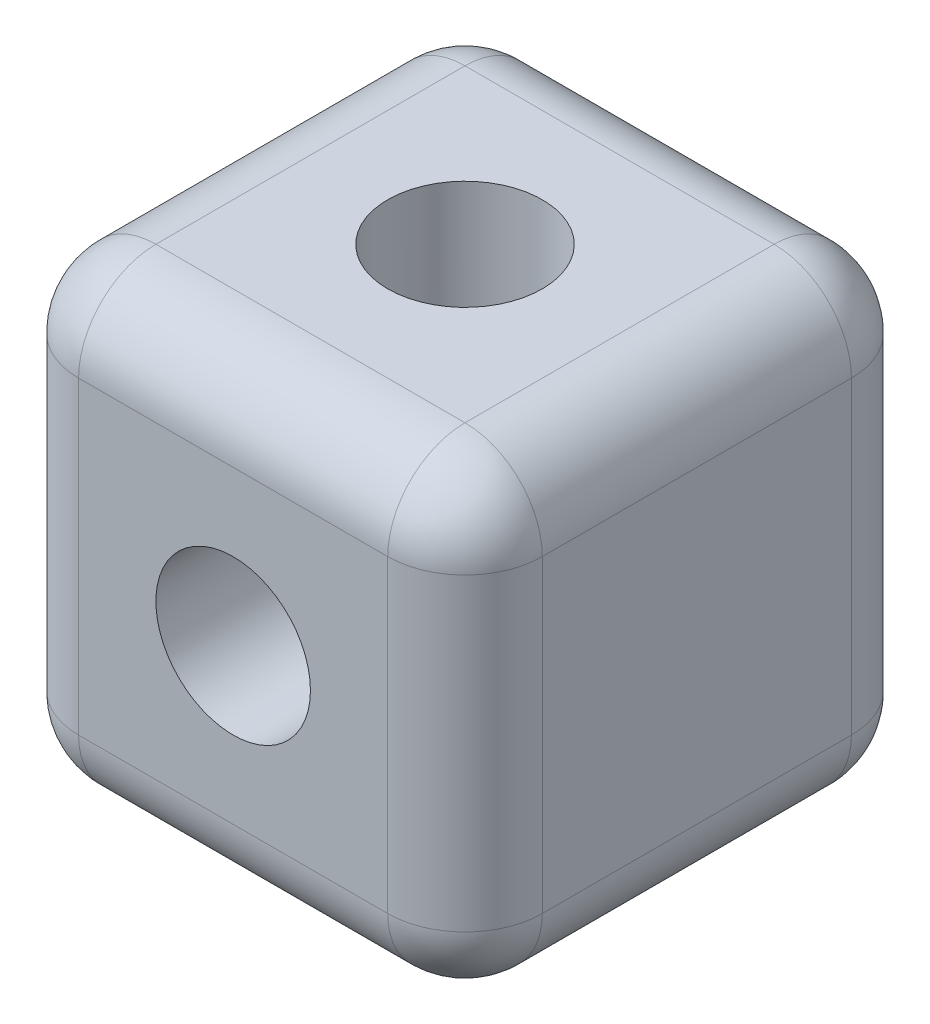
from build123d import *

# Parameters (mm, degrees)
SKETCH3_W           = 6
SKETCH3_H           = 6
BOSS_EXTRUDE1_DEPTH = 6
SKETCH4_R           = 1
CUT_EXTRUDE1_DEPTH  = 6
CUT_EXTRUDE2_REACH  = 9.348
SKETCH5_R           = 1
FILLET1_R           = 1


with BuildPart() as part:
    # Sketch3 → Boss-Extrude1 (new body)
    with BuildSketch(Plane(origin=(0, 0, 0), x_dir=(1, 0, 0), z_dir=(0, 1, 0))):
        Rectangle(SKETCH3_W, SKETCH3_H)
    extrude(amount=BOSS_EXTRUDE1_DEPTH)

    # Sketch4 → Cut-Extrude1 (cut)
    with BuildSketch(Plane.XY.offset(3)):
        with Locations((0, 3)):
            Circle(SKETCH4_R)
    extrude(amount=-CUT_EXTRUDE1_DEPTH, mode=Mode.SUBTRACT)

    # Cut-Extrude2: up to this face of the body (flat: up to its plane)
    cut_extrude2_end = Plane(part.part.faces().sort_by_distance((0, 0, 0))[0])
    # Sketch5 → Cut-Extrude2 (cut, up to the picked face)
    with BuildSketch(Plane(origin=(0, 6, 0), x_dir=(1, 0, 0), z_dir=(0, 1, 0)), mode=Mode.PRIVATE) as cut_extrude2_sk1:
        with Locations(Location((0, 0, 0), (0, 0, 270))):
            Circle(SKETCH5_R)
    cut_extrude2_tool1 = split(extrude(cut_extrude2_sk1.sketch, amount=-CUT_EXTRUDE2_REACH, mode=Mode.PRIVATE), bisect_by=cut_extrude2_end, keep=Keep.BOTH, mode=Mode.PRIVATE)
    add(cut_extrude2_tool1.solids().sort_by(Axis((0, 6, 0), (0, -1, 0)))[0], mode=Mode.SUBTRACT)

    # Fillet1
    fillet1_edges = [part.edges().sort_by_distance(p)[0] for p in [
        (-3, 6, 0),
        (0, 6, 3),
        (3, 6, 0),
        (0, 0, 3),
        (-3, 0, 0),
        (0, 0, -3),
        (3, 0, 0),
        (3, 3, 3),
        (-3, 3, 3),
        (-3, 3, -3),
        (3, 3, -3),
        (0, 6, -3),
    ]]
    fillet(fillet1_edges, radius=FILLET1_R)


solid = part.part
